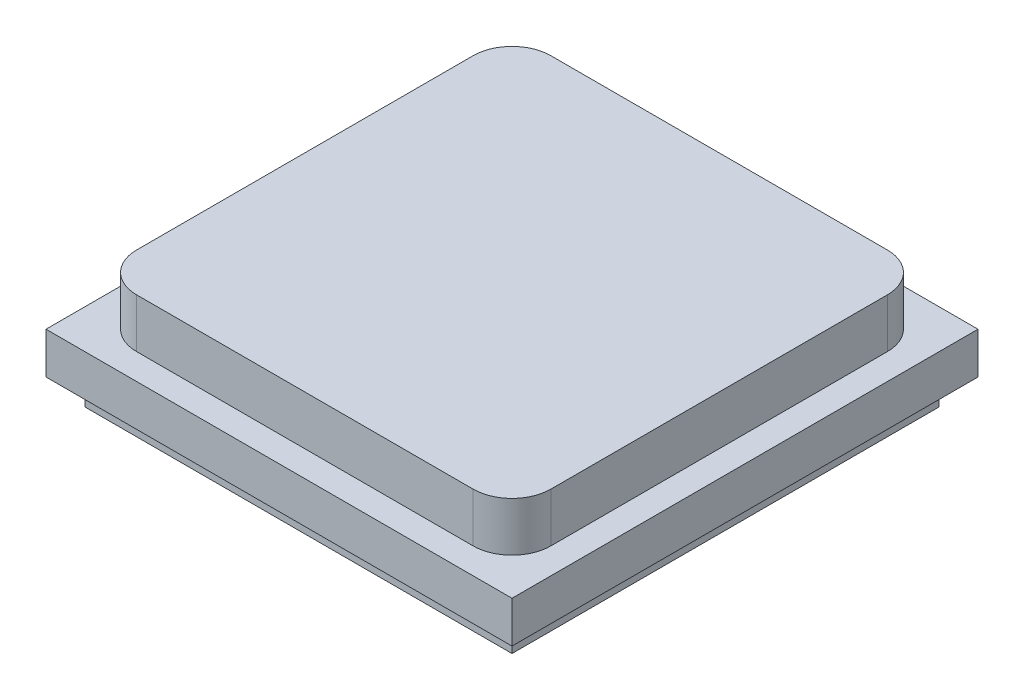
from build123d import *

# Parameters (mm, degrees)
SKETCH_1_W      = 18
SKETCH_1_H      = 18
EXTRUDE_1_DEPTH = 1.6
EXTRUDE_START   = 1.6
EXTRUDE_2_DEPTH = 1.9
SKETCH_3_W      = 16.5
SKETCH_3_H      = 16.5
EXTRUDE_3_DEPTH = 1


with BuildPart() as part:
    # 草图1 → 凸台-拉伸1 (new body)
    with BuildSketch(Plane(origin=(0, 0, 0), x_dir=(1, 0, 0), z_dir=(0, 1, 0))):
        Rectangle(SKETCH_1_W, SKETCH_1_H)
    extrude(amount=EXTRUDE_1_DEPTH)

    # 草图2 → 凸台-拉伸2 (add)
    with BuildSketch(Plane(origin=(0, 0, 0), x_dir=(1, 0, 0), z_dir=(0, 1, 0)).offset(EXTRUDE_START)):
        with BuildLine():
            Line((-6.5, 8), (6.5, 8))
            ThreePointArc((6.5, 8), (7.560660172, 7.560660172), (8, 6.5))
            Line((8, 6.5), (8, -6.5))
            ThreePointArc((8, -6.5), (7.560660172, -7.560660172), (6.5, -8))
            Line((6.5, -8), (-6.5, -8))
            ThreePointArc((-6.5, -8), (-7.560660172, -7.560660172), (-8, -6.5))
            Line((-8, -6.5), (-8, 6.5))
            ThreePointArc((-8, 6.5), (-7.560660172, 7.560660172), (-6.5, 8))
        make_face()
    extrude(amount=EXTRUDE_2_DEPTH)

    # 草图3 → 凸台-拉伸3 (add)
    with BuildSketch(Plane(origin=(0, 0, 0), x_dir=(1, 0, 0), z_dir=(0, 1, 0))):
        Rectangle(SKETCH_3_W, SKETCH_3_H)
    extrude(amount=-EXTRUDE_3_DEPTH)


solid = part.part
